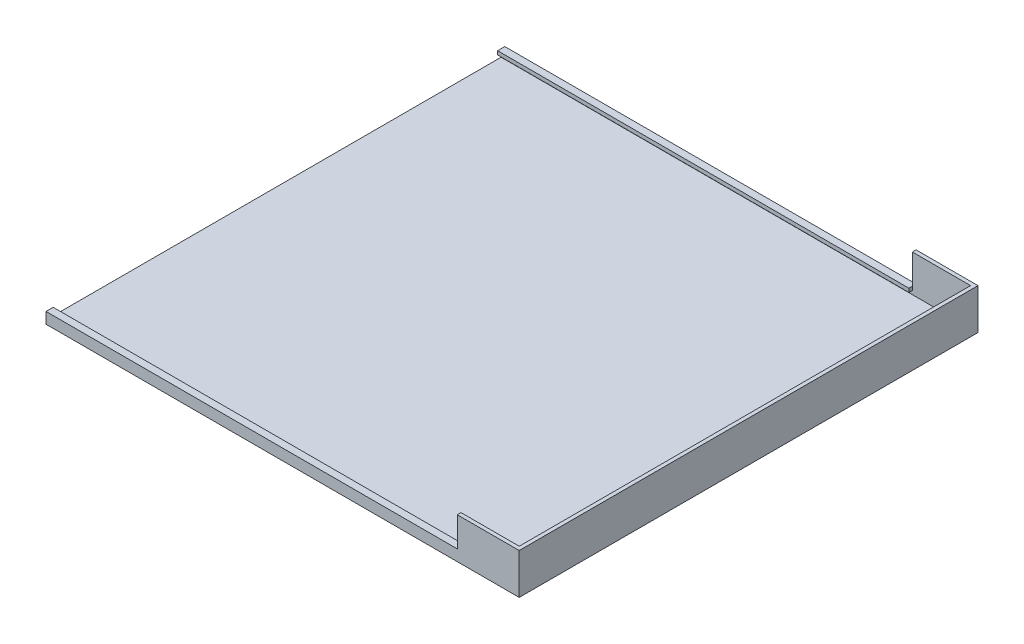
from build123d import *

# Parameters (mm, degrees)
SKETCH1_W           = 256
SKETCH1_H           = 248.2
BOSS_EXTRUDE1_DEPTH = 2
SKETCH2_W           = 256
SKETCH2_H           = 2
BOSS_EXTRUDE2_DEPTH = 4
SKETCH3_W           = 256
SKETCH3_H           = 1.999419648
BOSS_EXTRUDE3_DEPTH = 1.89
SKETCH4_W           = 256
SKETCH4_H           = 2
BOSS_EXTRUDE4_DEPTH = 1.89
SKETCH5_W           = 33.5
SKETCH5_H           = 3.89
CUT_EXTRUDE1_DEPTH  = 10
BOSS_EXTRUDE5_DEPTH = 20


with BuildPart() as part:
    # Sketch1 → Boss-Extrude1 (new body)
    with BuildSketch(Plane(origin=(0, 0, 0), x_dir=(1, 0, 0), z_dir=(0, 1, 0))):
        Rectangle(SKETCH1_W, SKETCH1_H)
    extrude(amount=BOSS_EXTRUDE1_DEPTH)

    # Sketch2 → Boss-Extrude2 (add)
    with BuildSketch(Plane(origin=(0, 2, 0), x_dir=(1, 0, 0), z_dir=(0, 1, 0))):
        with Locations((0, -123.1)):
            Rectangle(SKETCH2_W, SKETCH2_H)
        with Locations((0, 123.1)):
            Rectangle(SKETCH2_W, SKETCH2_H)
    extrude(amount=BOSS_EXTRUDE2_DEPTH)

    # Sketch3 → Boss-Extrude3 (add)
    with BuildSketch(Plane(origin=(0, 0, 122.1), x_dir=(-1, 0, 0), z_dir=(0, 0, -1))):
        with Locations((0, 5.000290176)):
            Rectangle(SKETCH3_W, SKETCH3_H)
    extrude(amount=BOSS_EXTRUDE3_DEPTH)

    # Sketch4 → Boss-Extrude4 (add)
    with BuildSketch(Plane.XY.offset(-122.1)):
        with Locations((0, 5)):
            Rectangle(SKETCH4_W, SKETCH4_H)
    extrude(amount=BOSS_EXTRUDE4_DEPTH)

    # Sketch5 → Cut-Extrude1 (cut)
    with BuildSketch(Plane(origin=(0, 2, 0), x_dir=(1, 0, 0), z_dir=(0, 1, 0))):
        with Locations((111.25, -122.155)):
            Rectangle(SKETCH5_W, SKETCH5_H)
        with Locations((111.25, 122.155)):
            Rectangle(SKETCH5_W, SKETCH5_H)
    extrude(amount=CUT_EXTRUDE1_DEPTH, mode=Mode.SUBTRACT)

    # Sketch6 → Boss-Extrude5 (add)
    with BuildSketch(Plane(origin=(0, 2, 0), x_dir=(1, 0, 0), z_dir=(0, 1, 0))):
        Polygon((94.5, -124.1), (94.5, -122.1), (126, -122.1), (126, 122.1), (94.5, 122.1), (94.5, 124.1), (128, 124.1), (128, -124.1), align=None)
    extrude(amount=BOSS_EXTRUDE5_DEPTH)


solid = part.part
